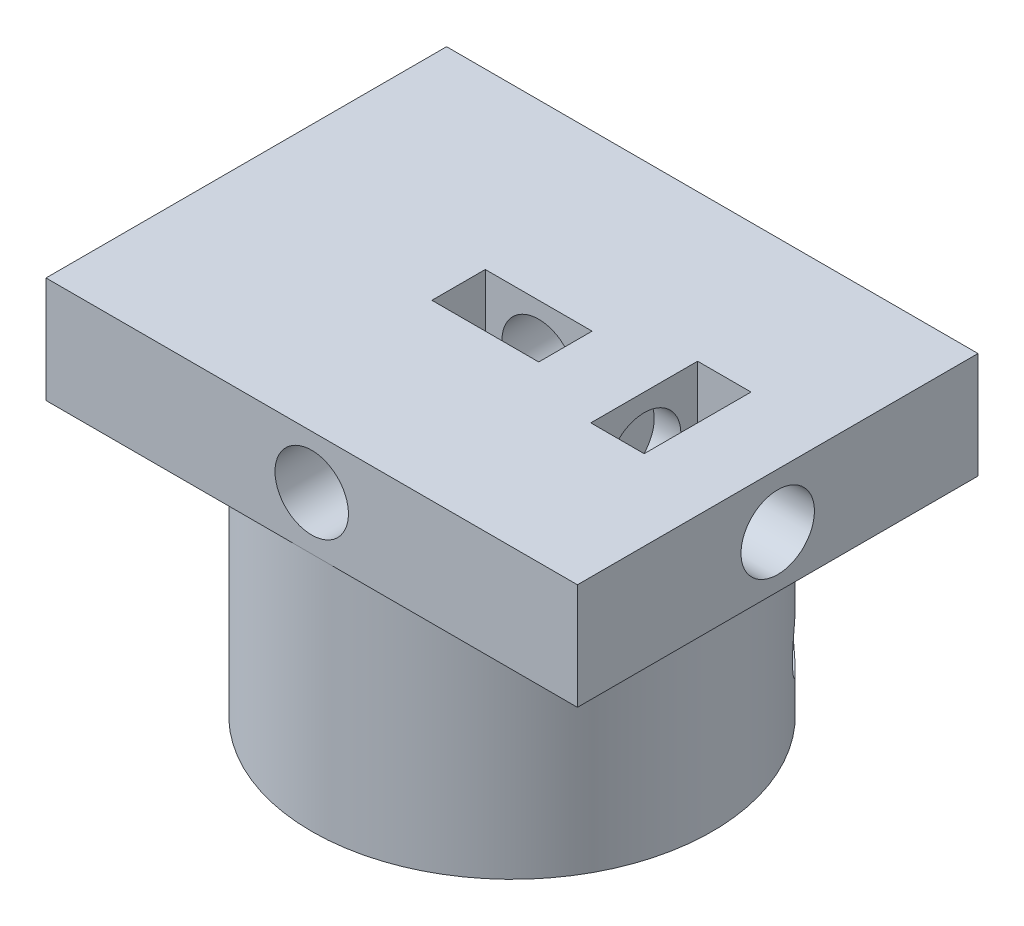
from build123d import *

# Parameters (mm, degrees)
SKETCH1_R              = 15
SKETCH1_R_2            = 4.5
BOSS_EXTRUDE1_DEPTH    = 9
SKETCH2_W              = 39.8
SKETCH2_H              = 30
BOSS_EXTRUDE2_DEPTH    = 7.95
M5_TAPPED_HOLE1_REACH  = 45.286
M5_TAPPED_HOLE1_BORE_R = 2.1
M5_TAPPED_HOLE2_REACH  = 45.286
M5_TAPPED_HOLE2_BORE_R = 2.1
SKETCH3_R              = 2.75
CUT_EXTRUDE1_DEPTH     = 40.790859579
SKETCH35_W             = 8
SKETCH35_H             = 4
SKETCH35_W_2           = 4
SKETCH35_H_2           = 8
CUT_EXTRUDE4_DEPTH     = 8
SKETCH40_R             = 2.75
CUT_EXTRUDE5_DEPTH     = 12


with BuildPart() as part:
    # Sketch1 → Boss-Extrude1 (new, symmetric)
    with BuildSketch(Plane(origin=(0, 0, 0), x_dir=(1, 0, 0), z_dir=(0, 1, 0))):
        with Locations(Location((0, 0, 0), (0, 0, 270))):
            Circle(SKETCH1_R)
        with Locations(Location((0, 0, 0), (0, 0, 270))):
            Circle(SKETCH1_R_2, mode=Mode.SUBTRACT)
    extrude(amount=BOSS_EXTRUDE1_DEPTH, both=True)

    # Sketch2 → Boss-Extrude2 (add)
    with BuildSketch(Plane(origin=(0, 9, 0), x_dir=(1, 0, 0), z_dir=(0, 1, 0))):
        Rectangle(SKETCH2_W, SKETCH2_H)
    extrude(amount=BOSS_EXTRUDE2_DEPTH)

    # M5 Tapped Hole1 bore → M5 Tapped Hole1 (cut, up to next)
    with BuildSketch(Plane(origin=(10.606601718, 0, -10.606601718), x_dir=(-0.7071067811865476, 0, -0.7071067811865476), z_dir=(0.7071067811865476, 0, -0.7071067811865476)), mode=Mode.PRIVATE) as m5_tapped_hole1_sk1:
        with Locations((0, -4)):
            Circle(M5_TAPPED_HOLE1_BORE_R)
    m5_tapped_hole1_tool1 = extrude(m5_tapped_hole1_sk1.sketch, amount=-M5_TAPPED_HOLE1_REACH, mode=Mode.PRIVATE) & part.part
    add(m5_tapped_hole1_tool1.solids().sort_by_distance((10.606602, -4, -10.606602))[0], mode=Mode.SUBTRACT)

    # M5 Tapped Hole2 bore → M5 Tapped Hole2 (cut, up to next)
    with BuildSketch(Plane(origin=(-10.606601718, 0, -10.606601718), x_dir=(-0.7071067811865476, 0, 0.7071067811865476), z_dir=(-0.7071067811865476, 0, -0.7071067811865476)), mode=Mode.PRIVATE) as m5_tapped_hole2_sk1:
        with Locations((0, -4)):
            Circle(M5_TAPPED_HOLE2_BORE_R)
    m5_tapped_hole2_tool1 = extrude(m5_tapped_hole2_sk1.sketch, amount=-M5_TAPPED_HOLE2_REACH, mode=Mode.PRIVATE) & part.part
    add(m5_tapped_hole2_tool1.solids().sort_by_distance((-10.606602, -4, -10.606602))[0], mode=Mode.SUBTRACT)

    # Sketch3 → Cut-Extrude1 (cut, through all)
    with BuildSketch(Plane(origin=(0, 0, -15), x_dir=(-1, 0, 0), z_dir=(0, 0, -1))):
        with Locations((0, 12.975)):
            Circle(SKETCH3_R)
    extrude(amount=-CUT_EXTRUDE1_DEPTH, mode=Mode.SUBTRACT)

    # Sketch35 → Cut-Extrude4 (cut)
    with BuildSketch(Plane(origin=(0, 16.95, 0), x_dir=(1, 0, 0), z_dir=(0, 1, 0))):
        Rectangle(SKETCH35_W, SKETCH35_H)
        with Locations((11.9, 0)):
            Rectangle(SKETCH35_W_2, SKETCH35_H_2)
    extrude(amount=-CUT_EXTRUDE4_DEPTH, mode=Mode.SUBTRACT)

    # Sketch40 → Cut-Extrude5 (cut)
    with BuildSketch(Plane(origin=(19.9, 0, 0), x_dir=(0, 0, -1), z_dir=(1, 0, 0))):
        with Locations((0, 12.8625)):
            Circle(SKETCH40_R)
    extrude(amount=-CUT_EXTRUDE5_DEPTH, mode=Mode.SUBTRACT)


solid = part.part
